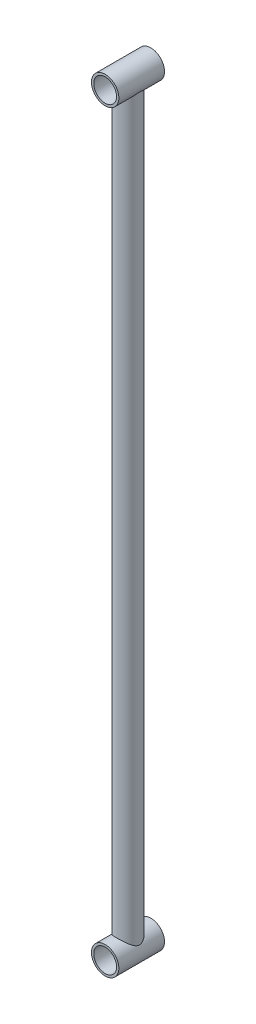
from build123d import *

# Parameters (mm, degrees)
SKETCH3_R           = 3.175
BOSS_EXTRUDE1_DEPTH = 104.775
SKETCH4_R           = 3.81
BOSS_EXTRUDE2_DEPTH = 6.35
SKETCH5_R           = 3.175
CUT_EXTRUDE1_DEPTH  = 12.7


with BuildPart() as part:
    # Sketch3 → Boss-Extrude1 (new, symmetric)
    with BuildSketch(Plane(origin=(0, 0, 0), x_dir=(1, 0, 0), z_dir=(0, 1, 0))):
        with Locations(Location((0, 0, 0), (0, 0, 270))):
            Circle(SKETCH3_R)
    extrude(amount=BOSS_EXTRUDE1_DEPTH, both=True)

    # Sketch4 → Boss-Extrude2 (add, symmetric)
    with BuildSketch(Plane.XY):
        with Locations((0, 104.775)):
            Circle(SKETCH4_R)
    boss_extrude2 = extrude(amount=BOSS_EXTRUDE2_DEPTH, both=True)

    # Sketch5 → Cut-Extrude1 (cut)
    with BuildSketch(Plane.XY.offset(6.35)):
        with Locations((0, 104.775)):
            Circle(SKETCH5_R)
    cut_extrude1 = extrude(amount=-CUT_EXTRUDE1_DEPTH, mode=Mode.SUBTRACT)

    # Mirror1: Boss-Extrude2, Cut-Extrude1 across plane
    add(boss_extrude2.mirror(Plane.ZX))
    add(cut_extrude1.mirror(Plane.ZX), mode=Mode.SUBTRACT)


solid = part.part
